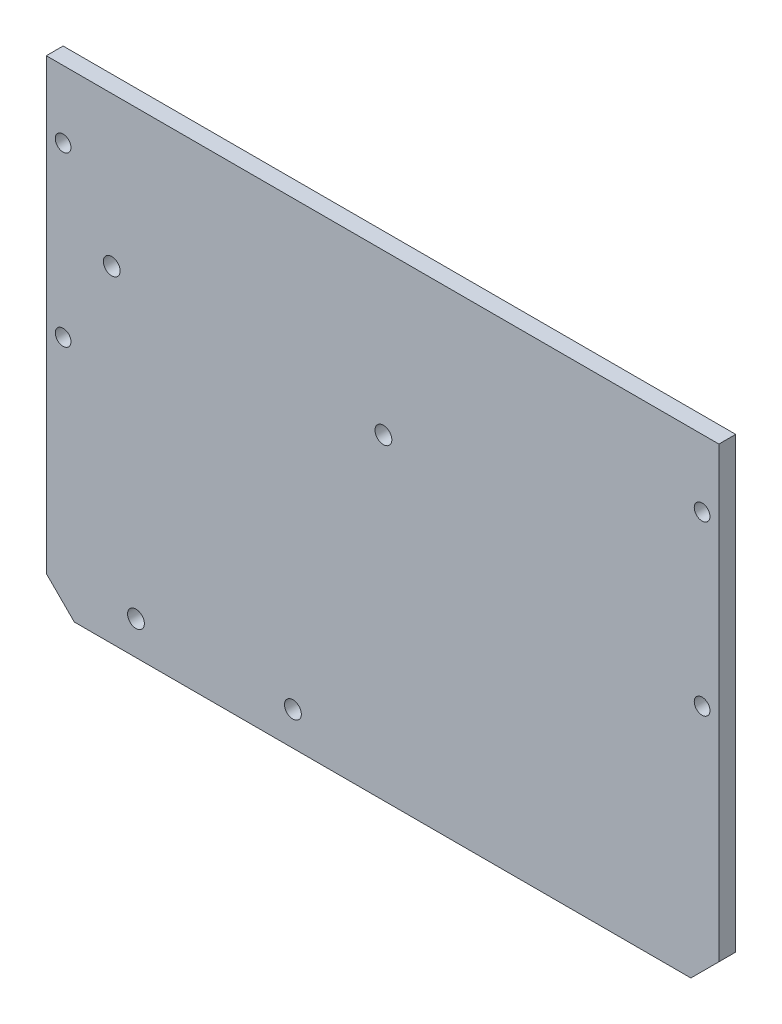
from build123d import *

# Parameters (mm, degrees)
SKETCH_1_W          = 120
SKETCH_1_H          = 85
EXTRUDE_1_DEPTH     = 3
SKETCH_2_R          = 1.4
CUT_EXTRUDE_1_DEPTH = 74.588382235
SKETCH_3_R          = 1.5
CUT_EXTRUDE_2_DEPTH = 74.588382235
CHAMFER_1_SIZE      = 5


with BuildPart() as part:
    # 草图1 → 凸台-拉伸1 (new body)
    with BuildSketch(Plane.XY):
        Rectangle(SKETCH_1_W, SKETCH_1_H)
    extrude(amount=EXTRUDE_1_DEPTH)

    # 草图2 → 切除-拉伸1 (cut, through all)
    with BuildSketch(Plane.XY.offset(3)):
        with Locations((-57, 30.5)):
            Circle(SKETCH_2_R)
        with Locations((-57, 0.5)):
            Circle(SKETCH_2_R)
        with Locations(Location((57, 30.5, 0), (0, 0, 180))):
            Circle(SKETCH_2_R)
        with Locations(Location((57, 0.5, 0), (0, 0, 180))):
            Circle(SKETCH_2_R)
    extrude(amount=-CUT_EXTRUDE_1_DEPTH, mode=Mode.SUBTRACT)

    # 草图3 → 切除-拉伸2 (cut, through all)
    with BuildSketch(Plane.XY.offset(3)):
        with Locations((-44, -36.5)):
            Circle(SKETCH_3_R)
        with Locations((-16, -36.5)):
            Circle(SKETCH_3_R)
        with Locations((-48.321428571, 15.821843002)):
            Circle(SKETCH_3_R)
        with Locations((0.1436431, 13.981509362)):
            Circle(SKETCH_3_R)
    extrude(amount=-CUT_EXTRUDE_2_DEPTH, mode=Mode.SUBTRACT)

    # 倒角1
    chamfer_1_edges = [part.edges().sort_by_distance(p)[0] for p in [
        (60, -42.5, 1.5),
        (-60, -42.5, 1.5),
    ]]
    chamfer(chamfer_1_edges, length=CHAMFER_1_SIZE)


solid = part.part
